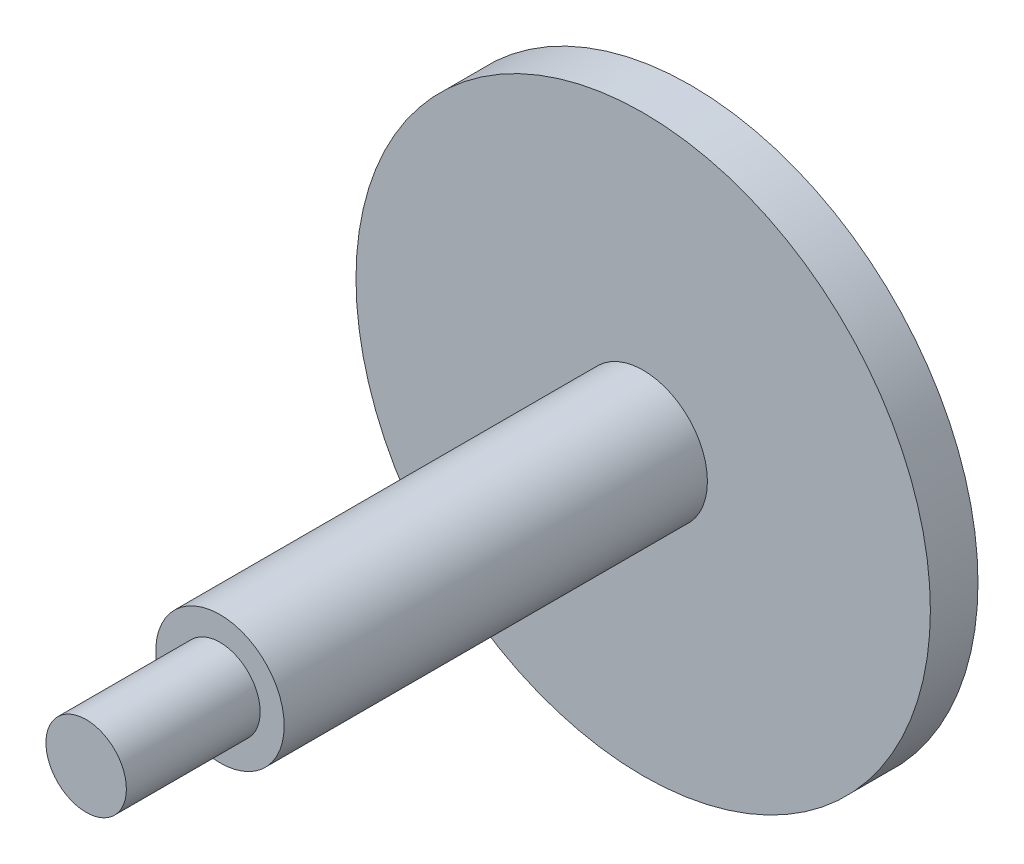
from build123d import *

# Parameters (mm, degrees)
SKETCH1_R           = 60.325
BOSS_EXTRUDE1_DEPTH = 10
SKETCH2_R           = 13.49375
BOSS_EXTRUDE2_DEPTH = 117
CUT_EXTRUDE1_START  = -28.1
SKETCH3_R           = 13.49375
CUT_EXTRUDE1_DEPTH  = 28.1
SKETCH4_R           = 8.449063039
BOSS_EXTRUDE3_DEPTH = 28.1


with BuildPart() as part:
    # Sketch1 → Boss-Extrude1 (new body)
    with BuildSketch(Plane.XY):
        Circle(SKETCH1_R)
    extrude(amount=BOSS_EXTRUDE1_DEPTH)

    # Sketch2 → Boss-Extrude2 (add)
    with BuildSketch(Plane.XY.offset(10)):
        Circle(SKETCH2_R)
    extrude(amount=BOSS_EXTRUDE2_DEPTH)

    # Sketch3 → Cut-Extrude1 (cut)
    with BuildSketch(Plane.XY.offset(127).offset(CUT_EXTRUDE1_START)):
        Circle(SKETCH3_R)
    extrude(amount=CUT_EXTRUDE1_DEPTH, mode=Mode.SUBTRACT)

    # Sketch4 → Boss-Extrude3 (add)
    with BuildSketch(Plane.XY.offset(98.9)):
        Circle(SKETCH4_R)
    extrude(amount=BOSS_EXTRUDE3_DEPTH)


solid = part.part
